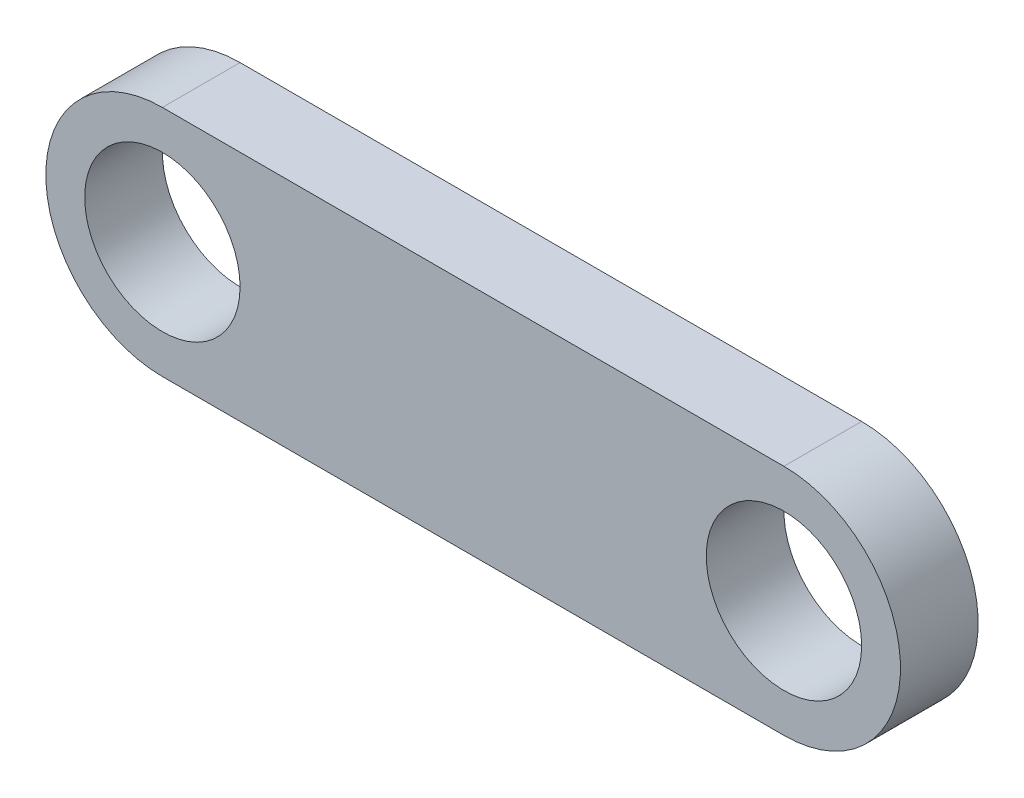
from build123d import *

# Parameters (mm, degrees)
SKETCH_1_R      = 10
EXTRUDE_1_DEPTH = 10


with BuildPart() as part:
    # 草图1 → 凸台-拉伸1 (new body)
    with BuildSketch(Plane.XY):
        with BuildLine():
            Line((0, 15), (80, 15))
            ThreePointArc((80, 15), (95, 0), (80, -15))
            Line((80, -15), (0, -15))
            ThreePointArc((0, -15), (-15, 0), (0, 15))
        make_face()
        Circle(SKETCH_1_R, mode=Mode.SUBTRACT)
        with Locations((80, 0)):
            Circle(SKETCH_1_R, mode=Mode.SUBTRACT)
    extrude(amount=EXTRUDE_1_DEPTH)


solid = part.part
